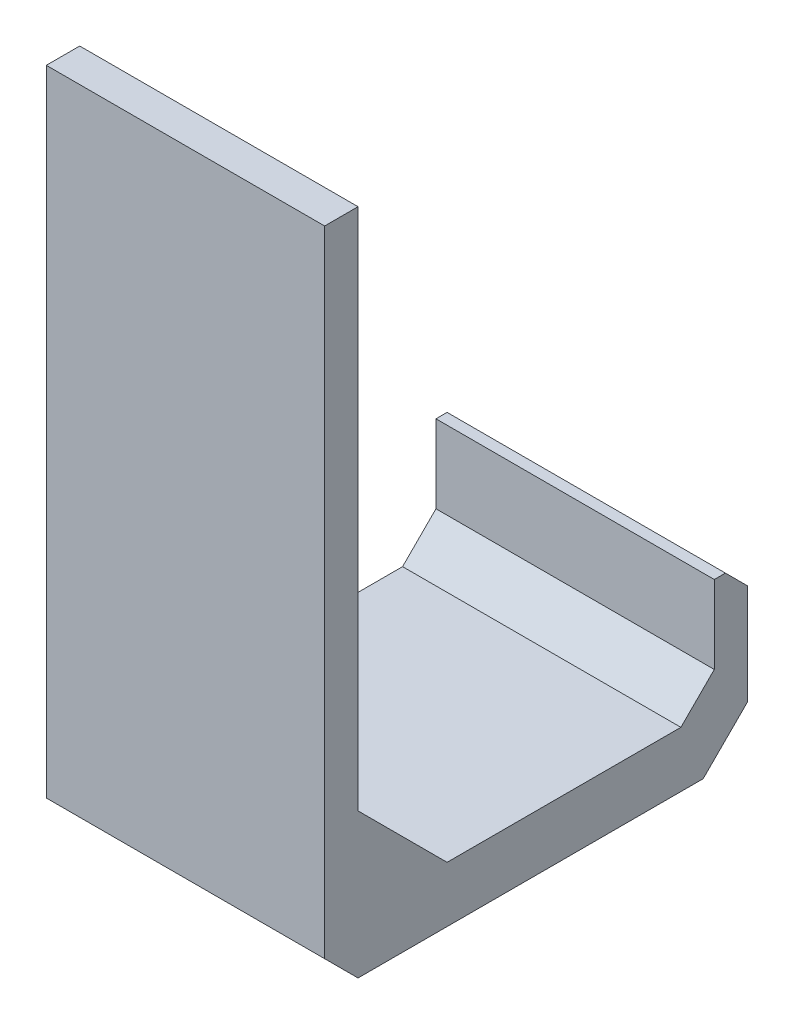
from build123d import *

# Parameters (mm, degrees)
BOSS_EXTRUDE1_DEPTH = 25
CHAMFER1_SIZE       = 8
CHAMFER2_SIZE       = 3
CHAMFER3_SIZE       = 4
CHAMFER4_SIZE       = 2


with BuildPart() as part:
    # Sketch1 → Boss-Extrude1 (new body)
    with BuildSketch(Plane(origin=(0, 0, 0), x_dir=(0, 0, -1), z_dir=(1, 0, 0))):
        Polygon((-10.227272727, 11.022727273), (-7.227272727, 11.022727273), (-7.227272727, -43.977272727), (24.772727273, -43.977272727), (24.772727273, -33.977272727), (27.772727273, -33.977272727), (27.772727273, -43.977272727), (27.772727273, -48.977272727), (-7.227272727, -48.977272727), (-10.227272727, -48.977272727), align=None)
    extrude(amount=BOSS_EXTRUDE1_DEPTH)

    # Chamfer1
    chamfer1_edges = [part.edges().sort_by_distance(p)[0] for p in [
        (12.5, -43.977272727, 7.227272727),
    ]]
    chamfer(chamfer1_edges, length=CHAMFER1_SIZE)

    # Chamfer2
    chamfer2_edges = [part.edges().sort_by_distance(p)[0] for p in [
        (12.5, -43.977272727, -24.772727273),
        (12.5, -48.977272727, 10.227272727),
    ]]
    chamfer(chamfer2_edges, length=CHAMFER2_SIZE)

    # Chamfer3
    chamfer3_edges = [part.edges().sort_by_distance(p)[0] for p in [
        (12.5, -48.977272727, -27.772727273),
    ]]
    chamfer(chamfer3_edges, length=CHAMFER3_SIZE)

    # Chamfer4
    chamfer4_edges = [part.edges().sort_by_distance(p)[0] for p in [
        (12.5, -33.977272727, -27.772727273),
    ]]
    chamfer(chamfer4_edges, length=CHAMFER4_SIZE)


solid = part.part
